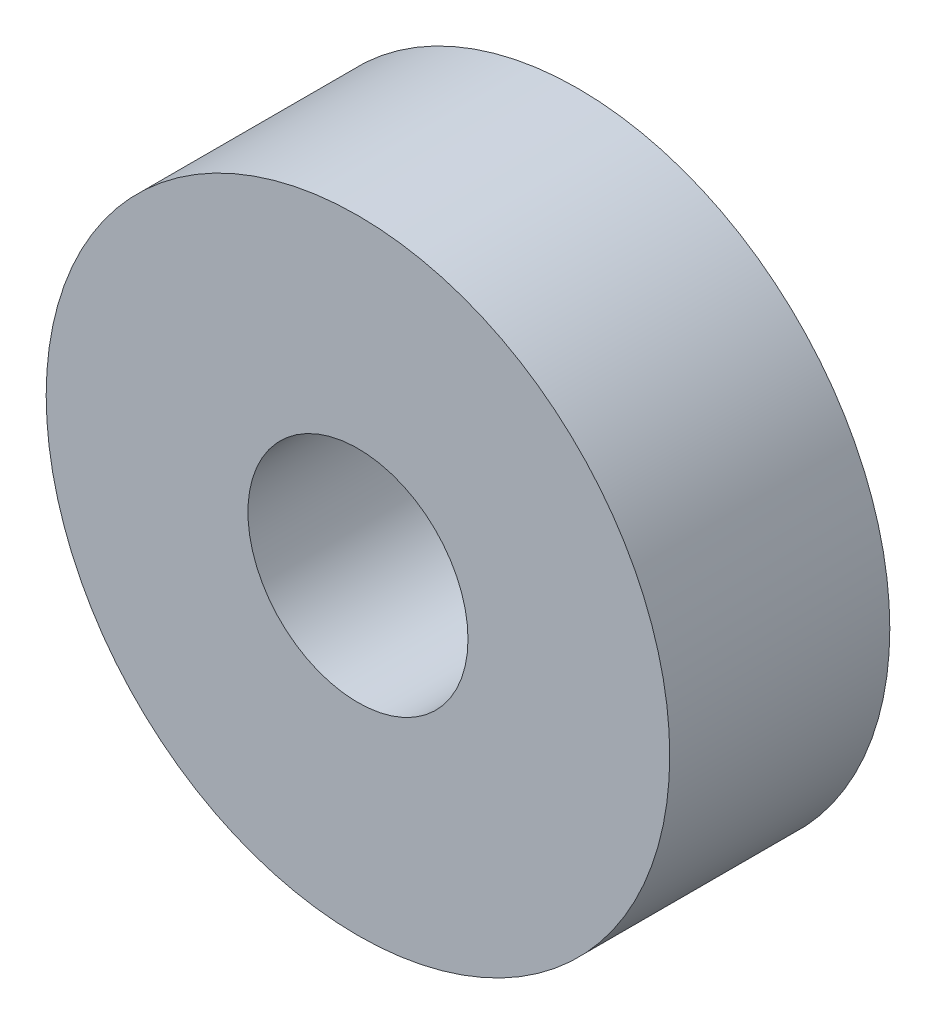
from build123d import *

# Parameters (mm, degrees)
SKETCH1_R           = 8.5
SKETCH1_R_2         = 3
BOSS_EXTRUDE1_DEPTH = 3


with BuildPart() as part:
    # Sketch1 → Boss-Extrude1 (new, symmetric)
    with BuildSketch(Plane.XY):
        Circle(SKETCH1_R)
        Circle(SKETCH1_R_2, mode=Mode.SUBTRACT)
    extrude(amount=BOSS_EXTRUDE1_DEPTH, both=True)


solid = part.part
